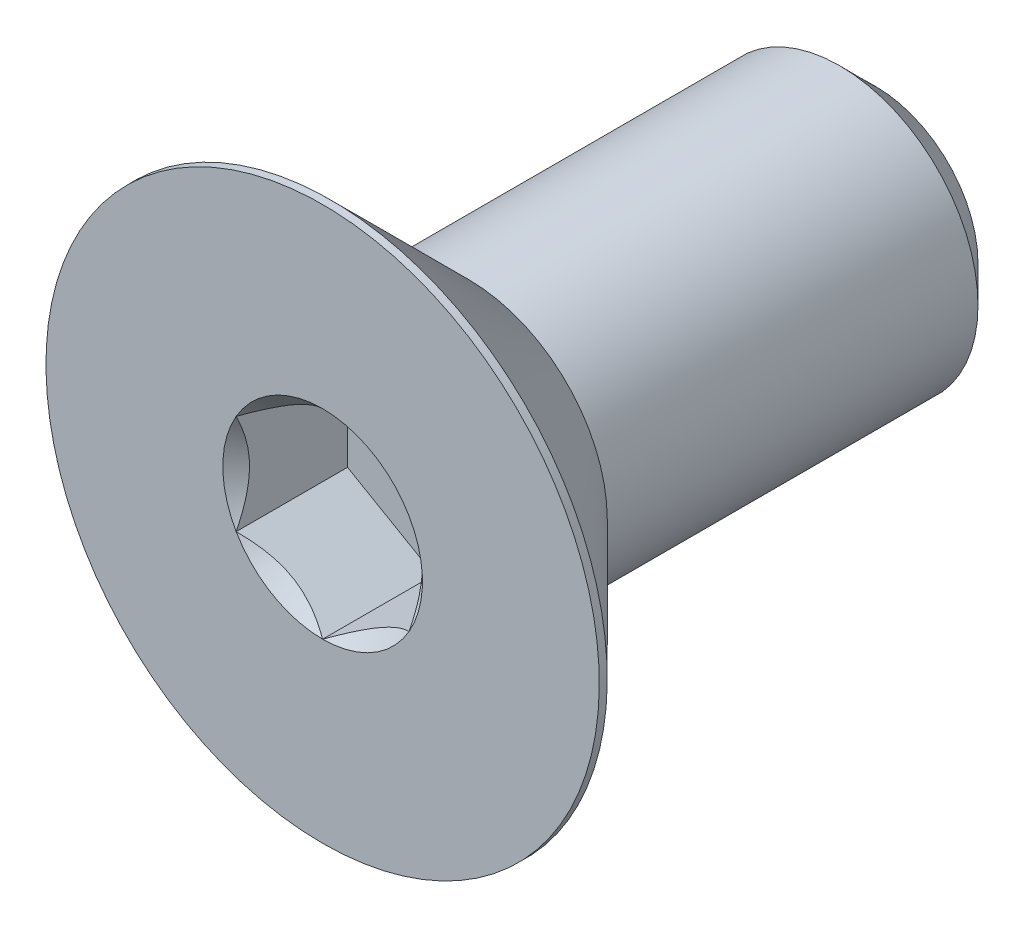
from build123d import *

# Parameters (mm, degrees)
CHAMFER1_SIZE      = 0.525
CUT_EXTRUDE2_DEPTH = 1.61


with BuildPart() as part:
    # Sketch1 → Revolve1 (revolve)
    with BuildSketch(Plane(origin=(0, 0, 0), x_dir=(0, 0, -1), z_dir=(1, 0, 0))):
        Polygon((-1.7, 2), (4, 2), (4, 0), (-2.39, 0), (-2.39, 2), align=None)
    revolve(axis=Axis((0, 0, 2.39), (0, 0, -1)))

    # Chamfer1
    chamfer1_edges = [part.edges().sort_by_distance(p)[0] for p in [
        (0, -2, -4),
    ]]
    chamfer(chamfer1_edges, length=CHAMFER1_SIZE)


with BuildPart() as body_2:
    # Sketch7 → Revolve2 (revolve)
    with BuildSketch(Plane(origin=(0, 0, 0), x_dir=(0, 0, -1), z_dir=(1, 0, 0))):
        Polygon((-3.885, 4), (-4, 4), (-4, 0), (-1.7, 0), (-1.7, 1.815), align=None)
    revolve(axis=Axis((0, 0, 4), (0, 0, -1)))

    # Sketch5 → Cut-Extrude2 (cut)
    with BuildSketch(Plane.XY.offset(4)):
        Polygon((1.25, -0.721687836), (1.25, 0.721687836), (0, 1.443375673), (-1.25, 0.721687836), (-1.25, -0.721687836), (0, -1.443375673), align=None)
    extrude(amount=-CUT_EXTRUDE2_DEPTH, mode=Mode.SUBTRACT)

    # Cut-Extrude3 cone 1 section (through the dimple's axis) → Cut-Extrude3 (revolve, cut)
    with BuildSketch(Plane(origin=(0, 0, 4), x_dir=(0, -1, 0), z_dir=(1, 0, 0))):
        Polygon((0, 0), (1.443375673, 0), (0, 1.443375673), align=None)
    revolve(axis=Axis((0, 0, 4), (0, 0, -1)), mode=Mode.SUBTRACT)

    # Combine1: union part
    add(part.part)


solid = body_2.part
